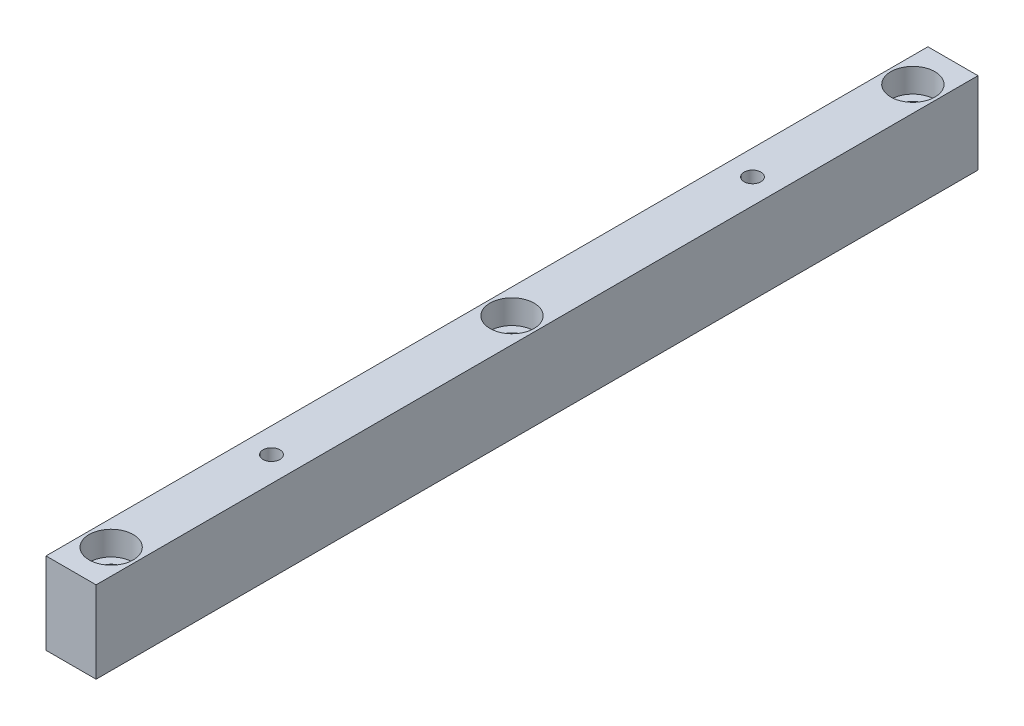
from build123d import *

# Parameters (mm, degrees)
SKETCH1_W                       = 12.5
SKETCH1_H                       = 220
BLOCO_DEPTH                     = 20.4
REBAIXO_M6_PASSANTE_D           = 6.6
REBAIXO_M6_PASSANTE_CBORE_D     = 11
REBAIXO_M6_PASSANTE_CBORE_DEPTH = 6
FURO_M5X0_8_PASSANTE_D          = 4.2


with BuildPart() as part:
    # Sketch1 → Bloco (new body)
    with BuildSketch(Plane(origin=(0, 0, 0), x_dir=(1, 0, 0), z_dir=(0, 1, 0))):
        with Locations((6.25, 110)):
            Rectangle(SKETCH1_W, SKETCH1_H)
    extrude(amount=BLOCO_DEPTH)

    # Rebaixo M6 - Passante (through all)
    with Locations(Plane(origin=(0, 20.4, 0), x_dir=(1, 0, 0), z_dir=(0, 1, 0))):
        with Locations((6.25, 10), (6.25, 110), (6.25, 210)):
            CounterBoreHole(REBAIXO_M6_PASSANTE_D / 2, REBAIXO_M6_PASSANTE_CBORE_D / 2, REBAIXO_M6_PASSANTE_CBORE_DEPTH)

    # Furo M5x0.8 - Passante (through all)
    with Locations(Plane(origin=(0, 20.4, 0), x_dir=(1, 0, 0), z_dir=(0, 1, 0))):
        with Locations((6.25, 50), (6.25, 170)):
            Hole(FURO_M5X0_8_PASSANTE_D / 2)


solid = part.part
